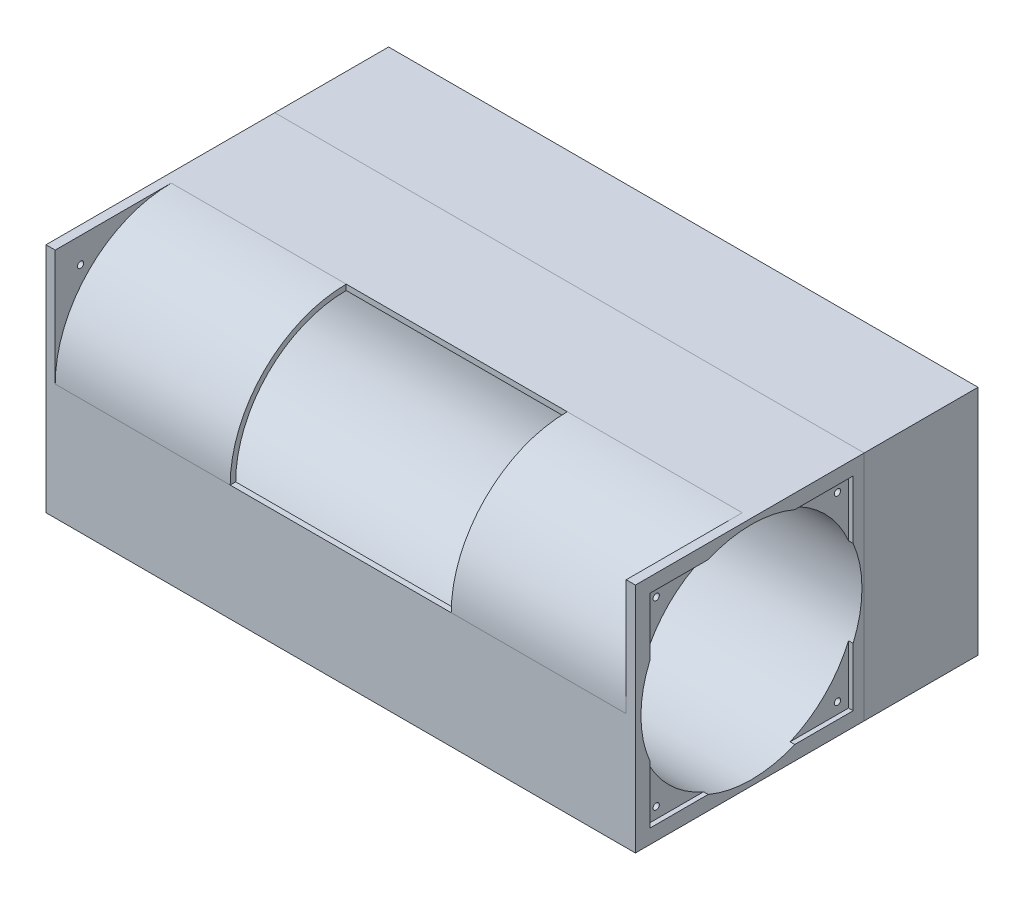
from build123d import *

# Parameters (mm, degrees)
SKETCH7_W           = 160.02
SKETCH7_H           = 160.02
BOSS_EXTRUDE4_DEPTH = 203.2
CUT_EXTRUDE3_DEPTH  = 196.85
SKETCH9_R           = 76.2
CUT_EXTRUDE4_DEPTH  = 422.85798582
SKETCH10_W          = 140.208
SKETCH10_H          = 140.208
CUT_EXTRUDE5_DEPTH  = 3.175
SKETCH11_W          = 152.4
SKETCH11_H          = 80.01
CUT_EXTRUDE6_DEPTH  = 80.01
SKETCH13_W          = 406.4
SKETCH13_H          = 160.02
BOSS_EXTRUDE6_DEPTH = 76.2
SKETCH15_W          = 74.676
SKETCH15_H          = 152.4
CUT_EXTRUDE7_DEPTH  = 200.025
SKETCH16_R          = 2.14999951
CUT_EXTRUDE8_DEPTH  = 440.765352006


with BuildPart() as part:
    # Sketch7 → Boss-Extrude4 (new, symmetric)
    with BuildSketch(Plane(origin=(0, 0, 0), x_dir=(0, 0, -1), z_dir=(1, 0, 0))):
        Rectangle(SKETCH7_W, SKETCH7_H)
    extrude(amount=BOSS_EXTRUDE4_DEPTH, both=True)

    # Sketch8 → Cut-Extrude3 (cut, symmetric)
    with BuildSketch(Plane(origin=(0, 0, 0), x_dir=(0, 0, -1), z_dir=(1, 0, 0))):
        with BuildLine():
            Line((-80.01, 80.01), (-80.01, 0))
            ThreePointArc((-80.01, 0), (-56.575613563, 56.575613563), (0, 80.01))
            Line((0, 80.01), (-80.01, 80.01))
        make_face()
    extrude(amount=CUT_EXTRUDE3_DEPTH, both=True, mode=Mode.SUBTRACT)

    # Sketch9 → Cut-Extrude4 (cut, through all)
    with BuildSketch(Plane(origin=(203.2, 0, 0), x_dir=(0, 0, -1), z_dir=(1, 0, 0))):
        Circle(SKETCH9_R)
    extrude(amount=-CUT_EXTRUDE4_DEPTH, mode=Mode.SUBTRACT)

    # Sketch10 → Cut-Extrude5 (cut)
    with BuildSketch(Plane(origin=(203.2, 0, 0), x_dir=(0, 0, -1), z_dir=(1, 0, 0))):
        Rectangle(SKETCH10_W, SKETCH10_H)
    cut_extrude5 = extrude(amount=-CUT_EXTRUDE5_DEPTH, mode=Mode.SUBTRACT)

    # Sketch11 → Cut-Extrude6 (cut)
    with BuildSketch(Plane.XY.offset(80.01)):
        with Locations((0, 40.005)):
            Rectangle(SKETCH11_W, SKETCH11_H)
    extrude(amount=-CUT_EXTRUDE6_DEPTH, mode=Mode.SUBTRACT)

    # Mirror1: Cut-Extrude5 across plane
    add(cut_extrude5.mirror(Plane(origin=(0, 0, 0), x_dir=(0, 0, 1), z_dir=(1, 0, 0))), mode=Mode.SUBTRACT)

    # Sketch13 → Boss-Extrude6 (add)
    with BuildSketch(Plane(origin=(0, 0, -80.01), x_dir=(-1, 0, 0), z_dir=(0, 0, -1))):
        Rectangle(SKETCH13_W, SKETCH13_H)
    extrude(amount=BOSS_EXTRUDE6_DEPTH)

    # Sketch15 → Cut-Extrude7 (cut, symmetric)
    with BuildSketch(Plane(origin=(0, 0, 0), x_dir=(0, 0, -1), z_dir=(1, 0, 0))):
        with Locations((118.872, 0)):
            Rectangle(SKETCH15_W, SKETCH15_H)
    extrude(amount=CUT_EXTRUDE7_DEPTH, both=True, mode=Mode.SUBTRACT)

    # Sketch16 → Cut-Extrude8 (cut, through all)
    with BuildSketch(Plane(origin=(200.025, 0, 0), x_dir=(0, 0, -1), z_dir=(1, 0, 0))):
        with Locations((-62.500002, 62.500002)):
            Circle(SKETCH16_R)
        with Locations(Location((62.500002, 62.500002, 0), (0, 0, 180))):
            Circle(SKETCH16_R)
        with Locations((-62.500002, -62.500002)):
            Circle(SKETCH16_R)
        with Locations(Location((62.500002, -62.500002, 0), (0, 0, 180))):
            Circle(SKETCH16_R)
    extrude(amount=-CUT_EXTRUDE8_DEPTH, mode=Mode.SUBTRACT)


with BuildPart() as body_2:
    # Split1: the piece on the far side of the plane
    add(part.part)
    split(bisect_by=Plane(origin=(0, 0, -77.724), x_dir=(-1, 0, 0), z_dir=(0, 0, -1)), keep=Keep.BOTTOM)


with BuildPart() as part_1:
    add(part.part)

    # Split1
    split(bisect_by=Plane(origin=(0, 0, -77.724), x_dir=(-1, 0, 0), z_dir=(0, 0, -1)), keep=Keep.TOP)


solid = Compound([body_2.part, part_1.part])
